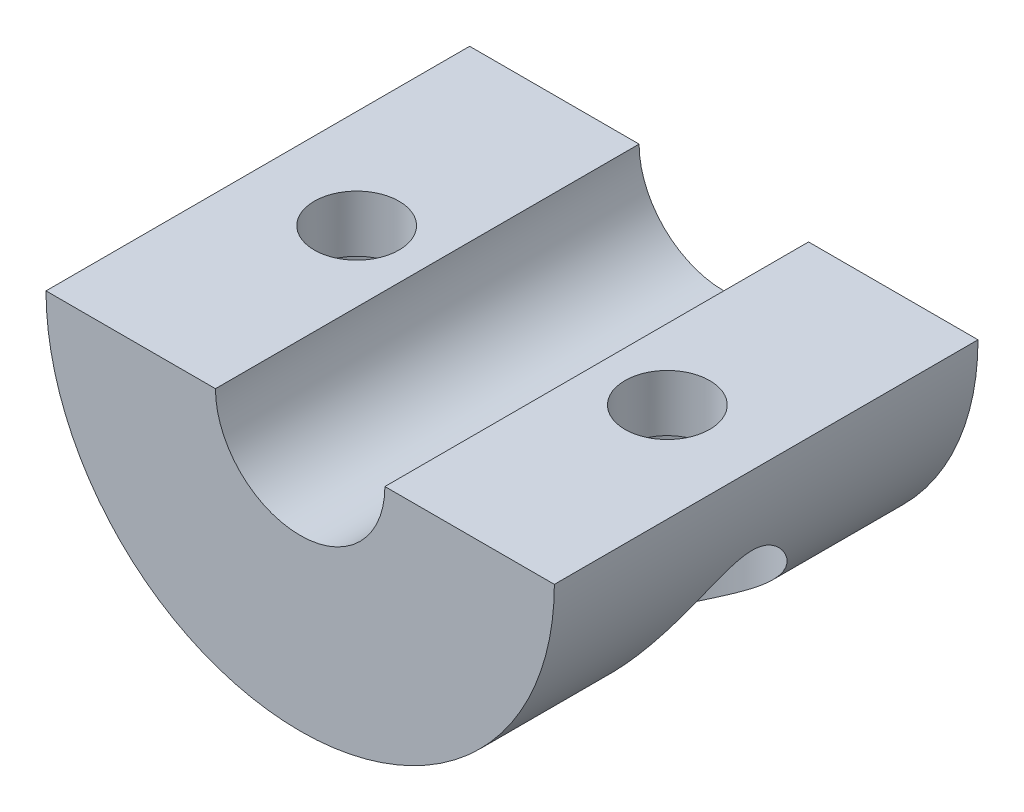
from build123d import *

# Parameters (mm, degrees)
BOSS_EXTRUDE1_DEPTH = 15
SKETCH2_R           = 3
CUT_EXTRUDE1_DEPTH  = 15
SKETCH3_R           = 1.5
CUT_EXTRUDE2_DEPTH  = 15


with BuildPart() as part:
    # Sketch1 → Boss-Extrude1 (new body)
    with BuildSketch(Plane.XY):
        with BuildLine():
            Line((9, 0), (3, 0))
            ThreePointArc((3, 0), (0, -3), (-3, 0))
            Line((-3, 0), (-9, 0))
            ThreePointArc((-9, 0), (0, -9), (9, 0))
        make_face()
    extrude(amount=BOSS_EXTRUDE1_DEPTH)

    # Sketch2 → Cut-Extrude1 (cut)
    with BuildSketch(Plane(origin=(0, -2, 0), x_dir=(1, 0, 0), z_dir=(0, 1, 0))):
        with Locations(Location((5.5, -7.5, 0), (0, 0, 270))):
            Circle(SKETCH2_R)
    cut_extrude1 = extrude(amount=-CUT_EXTRUDE1_DEPTH, mode=Mode.SUBTRACT)

    # Sketch3 → Cut-Extrude2 (cut)
    with BuildSketch(Plane.XZ.offset(2)):
        with Locations(Location((5.5, 7.5, 0), (0, 0, 270))):
            Circle(SKETCH3_R)
    cut_extrude2 = extrude(amount=-CUT_EXTRUDE2_DEPTH, mode=Mode.SUBTRACT)

    # Mirror1: Cut-Extrude1, Cut-Extrude2 across plane
    add(cut_extrude1.mirror(Plane(origin=(0, 0, 0), x_dir=(0, 0, 1), z_dir=(1, 0, 0))), mode=Mode.SUBTRACT)
    add(cut_extrude2.mirror(Plane(origin=(0, 0, 0), x_dir=(0, 0, 1), z_dir=(1, 0, 0))), mode=Mode.SUBTRACT)


solid = part.part
